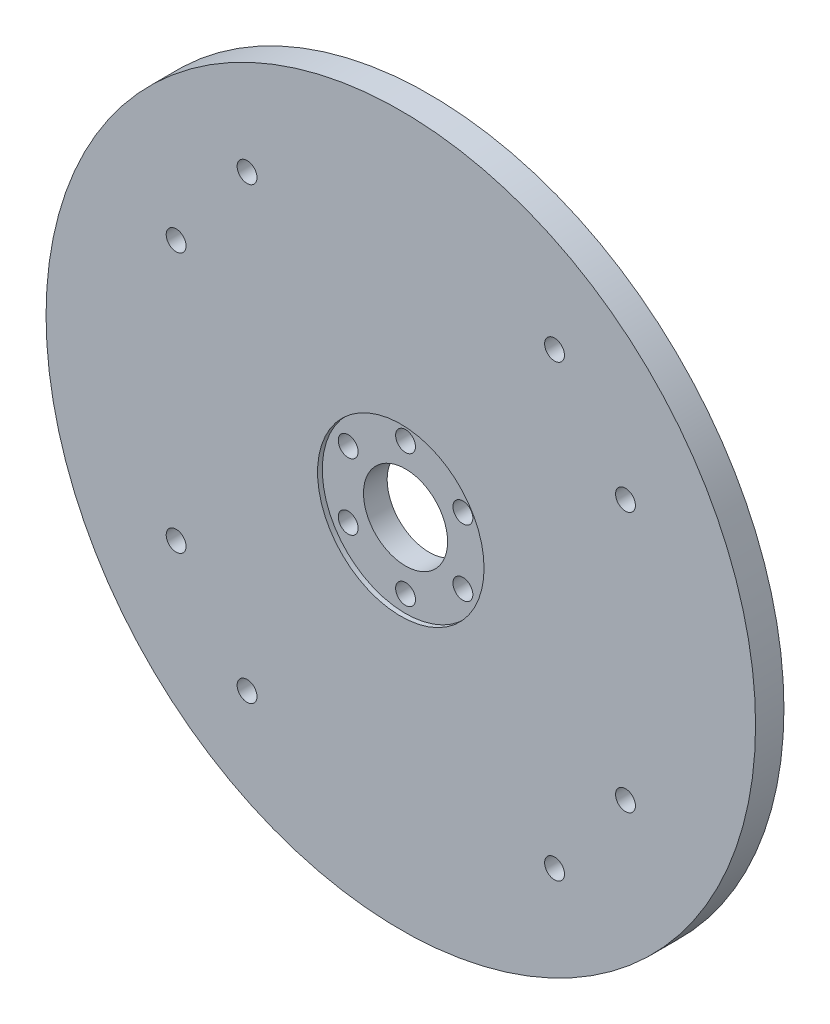
from build123d import *

# Parameters (mm, degrees)
SKETCH_1_R           = 40
EXTRUDE_1_DEPTH      = 2
SKETCH_2_R           = 34
CUT_EXTRUDE_1_DEPTH  = 0.5
SKETCH_3_R           = 17.5
CUT_EXTRUDE_4_DEPTH  = 1
SKETCH_5_R           = 2
CUT_EXTRUDE_5_DEPTH  = 1
SKETCH_6_R           = 8
CUT_EXTRUDE_6_DEPTH  = 10
SKETCH_7_R           = 2.1
CUT_EXTRUDE_7_DEPTH  = 10
SKETCH_8_R           = 70
SKETCH_8_R_2         = 40
EXTRUDE_2_DEPTH      = 2
EXTRUDE_3_DEPTH      = 2
SKETCH_11_R          = 75
SKETCH_11_R_2        = 2.1
SKETCH_11_R_3        = 8
EXTRUDE_4_DEPTH      = 2
SKETCH_13_W          = 95.696329608
SKETCH_13_H          = 36
SKETCH_13_W_2        = 36
SKETCH_13_H_2        = 100.137159233
SKETCH_13_H_3        = 96.241749767
CUT_EXTRUDE_10_DEPTH = 198
SKETCH_11_3_R        = 75
SKETCH_11_3_R_2      = 2.1
SKETCH_11_3_R_3      = 8
EXTRUDE_5_DEPTH      = 2
SKETCH_17_R          = 1.65
CUT_EXTRUDE_12_DEPTH = 280
SKETCH_18_R          = 234.864992374
CUT_EXTRUDE_13_DEPTH = 222
SKETCH_20_R          = 8.888358942
CUT_EXTRUDE_15_DEPTH = 17
SKETCH_28_R          = 17.5
CUT_EXTRUDE_16_DEPTH = 1
SKETCH_34_R          = 17.6
CUT_EXTRUDE_22_DEPTH = 1
SKETCH_30_R          = 2.1
CUT_EXTRUDE_27_DEPTH = 10
SKETCH_33_R          = 2.1
CUT_EXTRUDE_28_DEPTH = 10
EXTRUDE_START        = 4
SKETCH_40_R          = 75
SKETCH_40_R_2        = 8.888358942
SKETCH_40_R_3        = 2.1
EXTRUDE_6_DEPTH      = 4


with BuildPart() as part:
    # 草图1 → 凸台-拉伸1 (new body)
    with BuildSketch(Plane.XY):
        Circle(SKETCH_1_R)
    extrude(amount=EXTRUDE_1_DEPTH)

    # 草图2 → 切除-拉伸1 (cut)
    with BuildSketch(Plane.XY.offset(2)):
        Circle(SKETCH_2_R)
    extrude(amount=-CUT_EXTRUDE_1_DEPTH, mode=Mode.SUBTRACT)

    # 草图3 → 切除-拉伸4 (cut)
    with BuildSketch(Plane.XY.offset(1.5)):
        Circle(SKETCH_3_R)
    extrude(amount=-CUT_EXTRUDE_4_DEPTH, mode=Mode.SUBTRACT)

    # 草图5 → 切除-拉伸5 (cut)
    with BuildSketch(Plane.XY.offset(0.5)):
        with Locations((0, 14)):
            Circle(SKETCH_5_R)
        with Locations((12.124355653, 7)):
            Circle(SKETCH_5_R)
        with Locations((12.124355653, -7)):
            Circle(SKETCH_5_R)
        with Locations((0, -14)):
            Circle(SKETCH_5_R)
        with Locations((-12.124355653, -7)):
            Circle(SKETCH_5_R)
        with Locations((-12.124355653, 7)):
            Circle(SKETCH_5_R)
    extrude(amount=-CUT_EXTRUDE_5_DEPTH, mode=Mode.SUBTRACT)

    # 草图6 → 切除-拉伸6 (cut)
    with BuildSketch(Plane(origin=(0, 0, 0), x_dir=(-1, 0, 0), z_dir=(0, 0, -1))):
        Circle(SKETCH_6_R)
    extrude(amount=-CUT_EXTRUDE_6_DEPTH, mode=Mode.SUBTRACT)

    # 草图7 → 切除-拉伸7 (cut)
    with BuildSketch(Plane(origin=(0, 0, 0), x_dir=(-1, 0, 0), z_dir=(0, 0, -1))):
        with Locations((0, 14)):
            Circle(SKETCH_7_R)
        with Locations((12.124355653, 7)):
            Circle(SKETCH_7_R)
        with Locations((12.124355653, -7)):
            Circle(SKETCH_7_R)
        with Locations((0, -14)):
            Circle(SKETCH_7_R)
        with Locations((-12.124355653, -7)):
            Circle(SKETCH_7_R)
        with Locations((-12.124355653, 7)):
            Circle(SKETCH_7_R)
    extrude(amount=-CUT_EXTRUDE_7_DEPTH, mode=Mode.SUBTRACT)

    # 草图8 → 凸台-拉伸2 (add)
    with BuildSketch(Plane(origin=(0, 0, 0), x_dir=(-1, 0, 0), z_dir=(0, 0, -1))):
        Circle(SKETCH_8_R)
        Circle(SKETCH_8_R_2, mode=Mode.SUBTRACT)
    extrude(amount=-EXTRUDE_2_DEPTH)

    # 草图9 → 凸台-拉伸3 (add)
    with BuildSketch(Plane(origin=(0, 0, 0), x_dir=(-1, 0, 0), z_dir=(0, 0, -1))):
        with BuildLine():
            ThreePointArc((-36.858328143, 59.510197836), (-0.940414163, 69.993682724), (35.246189577, 60.478972547))
            Line((35.246189577, 60.478972547), (35.246189577, 159.510197836))
            Line((35.246189577, 159.510197836), (-36.858328143, 159.510197836))
            Line((-36.858328143, 159.510197836), (-36.858328143, 59.510197836))
        make_face()
        with BuildLine():
            ThreePointArc((-60, -36.055512755), (-70, 0), (-60, 36.055512755))
            Line((-60, 36.055512755), (-160, 36.055512755))
            Line((-160, 36.055512755), (-160, -36.055512755))
            Line((-160, -36.055512755), (-60, -36.055512755))
        make_face()
        with BuildLine():
            Line((160, 36.055512755), (60, 36.055512755))
            ThreePointArc((60, 36.055512755), (70, 0), (60, -36.055512755))
            Line((60, -36.055512755), (160, -36.055512755))
            Line((160, -36.055512755), (160, 36.055512755))
        make_face()
        with BuildLine():
            ThreePointArc((35.246189577, -60.478972547), (-0.940414163, -69.993682724), (-36.858328143, -59.510197836))
            Line((-36.858328143, -59.510197836), (-36.858328143, -160.478972547))
            Line((-36.858328143, -160.478972547), (35.246189577, -160.478972547))
            Line((35.246189577, -160.478972547), (35.246189577, -60.478972547))
        make_face()
    extrude(amount=-EXTRUDE_3_DEPTH)

    # 草图11 → 凸台-拉伸4 (add)
    with BuildSketch(Plane(origin=(0, 0, 0), x_dir=(-1, 0, 0), z_dir=(0, 0, -1))):
        Circle(SKETCH_11_R)
        with Locations((0, -14)):
            Circle(SKETCH_11_R_2, mode=Mode.SUBTRACT)
        with Locations((-12.124355653, -7)):
            Circle(SKETCH_11_R_2, mode=Mode.SUBTRACT)
        with Locations((-12.124355653, 7)):
            Circle(SKETCH_11_R_2, mode=Mode.SUBTRACT)
        Circle(SKETCH_11_R_3, mode=Mode.SUBTRACT)
        with Locations((12.124355653, -7)):
            Circle(SKETCH_11_R_2, mode=Mode.SUBTRACT)
        with Locations((12.124355653, 7)):
            Circle(SKETCH_11_R_2, mode=Mode.SUBTRACT)
        with Locations((0, 14)):
            Circle(SKETCH_11_R_2, mode=Mode.SUBTRACT)
    extrude(amount=-EXTRUDE_4_DEPTH)

    # 草图13 → 切除-拉伸10 (cut)
    with BuildSketch(Plane(origin=(0, 0, 0), x_dir=(-1, 0, 0), z_dir=(0, 0, -1))):
        with Locations((-112.151835196, 0)):
            Rectangle(SKETCH_13_W, SKETCH_13_H)
        with Locations((0, 109.44161822)):
            Rectangle(SKETCH_13_W_2, SKETCH_13_H_2)
        Polygon((160, -18), (160, 18), (157.649128195, 18), (52.463986971, 18), (52.463986971, -18), align=None)
        with Locations((0, -112.358097664)):
            Rectangle(SKETCH_13_W_2, SKETCH_13_H_3)
    extrude(amount=-CUT_EXTRUDE_10_DEPTH, mode=Mode.SUBTRACT)

    # 草图11<3> → 凸台-拉伸5 (add)
    with BuildSketch(Plane(origin=(0, 0, 0), x_dir=(-1, 0, 0), z_dir=(0, 0, -1))):
        Circle(SKETCH_11_3_R)
        with Locations((0, -14)):
            Circle(SKETCH_11_3_R_2, mode=Mode.SUBTRACT)
        with Locations((-12.124355653, -7)):
            Circle(SKETCH_11_3_R_2, mode=Mode.SUBTRACT)
        with Locations((-12.124355653, 7)):
            Circle(SKETCH_11_3_R_2, mode=Mode.SUBTRACT)
        Circle(SKETCH_11_3_R_3, mode=Mode.SUBTRACT)
        with Locations((12.124355653, -7)):
            Circle(SKETCH_11_3_R_2, mode=Mode.SUBTRACT)
        with Locations((12.124355653, 7)):
            Circle(SKETCH_11_3_R_2, mode=Mode.SUBTRACT)
        with Locations((0, 14)):
            Circle(SKETCH_11_3_R_2, mode=Mode.SUBTRACT)
    extrude(amount=-EXTRUDE_5_DEPTH)

    # 草图17 → 切除-拉伸12 (cut)
    with BuildSketch(Plane(origin=(0, 0, 0), x_dir=(-1, 0, 0), z_dir=(0, 0, -1))):
        with Locations((-157.6, 27.027756377)):
            Circle(SKETCH_17_R)
        with Locations((-132.6, 27.027756377)):
            Circle(SKETCH_17_R)
        with Locations((-157.6, -27.027756377)):
            Circle(SKETCH_17_R)
        with Locations((-132.6, -27.027756377)):
            Circle(SKETCH_17_R)
        with Locations((27.027756377, 157.6)):
            Circle(SKETCH_17_R)
        with Locations((27.027756377, 132.6)):
            Circle(SKETCH_17_R)
        with Locations((-27.027756377, 157.6)):
            Circle(SKETCH_17_R)
        with Locations((-27.027756377, 132.6)):
            Circle(SKETCH_17_R)
        with Locations((157.6, 27.027756377)):
            Circle(SKETCH_17_R)
        with Locations((132.6, 27.027756377)):
            Circle(SKETCH_17_R)
        with Locations((-27.027756377, -157.6)):
            Circle(SKETCH_17_R)
        with Locations((-27.027756377, -132.6)):
            Circle(SKETCH_17_R)
        with Locations((27.027756377, -157.6)):
            Circle(SKETCH_17_R)
        with Locations((27.027756377, -132.6)):
            Circle(SKETCH_17_R)
    extrude(amount=-CUT_EXTRUDE_12_DEPTH, mode=Mode.SUBTRACT)

    # 草图18 → 切除-拉伸13 (cut)
    with BuildSketch(Plane(origin=(0, 0, 0), x_dir=(-1, 0, 0), z_dir=(0, 0, -1))):
        Circle(SKETCH_18_R)
        with BuildLine():
            ThreePointArc((72.807966597, -18), (-74.999955067, -0.082097142), (72.768385514, 18.159352128))
            ThreePointArc((72.768385514, 18.159352128), (74.440005755, 9.147980282), (75, 0))
            ThreePointArc((75, 0), (74.449974798, -9.066490645), (72.807966597, -18))
        make_face(mode=Mode.SUBTRACT)
        with BuildLine():
            ThreePointArc((159.25, 27.027756377), (157.6, 25.377756377), (155.95, 27.027756377))
            ThreePointArc((155.95, 27.027756377), (157.6, 28.677756377), (159.25, 27.027756377))
        make_face(mode=Mode.SUBTRACT)
    extrude(amount=-CUT_EXTRUDE_13_DEPTH, mode=Mode.SUBTRACT)

    # 草图20 → 切除-拉伸15 (cut)
    with BuildSketch(Plane(origin=(0, 0, 0), x_dir=(-1, 0, 0), z_dir=(0, 0, -1))):
        Circle(SKETCH_20_R)
    extrude(amount=-CUT_EXTRUDE_15_DEPTH, mode=Mode.SUBTRACT)

    # 草图28 → 切除-拉伸16 (cut)
    with BuildSketch(Plane.XY.offset(2)):
        Circle(SKETCH_28_R)
    extrude(amount=-CUT_EXTRUDE_16_DEPTH, mode=Mode.SUBTRACT)

    # 草图34 → 切除-拉伸22 (cut)
    with BuildSketch(Plane.XY.offset(2)):
        Circle(SKETCH_34_R)
    extrude(amount=-CUT_EXTRUDE_22_DEPTH, mode=Mode.SUBTRACT)

    # 草图30 → 切除-拉伸27 (cut)
    with BuildSketch(Plane(origin=(0, 0, 0), x_dir=(-1, 0, 0), z_dir=(0, 0, -1))):
        with Locations((-32.5, -47.5)):
            Circle(SKETCH_30_R)
        with Locations((32.5, -47.5)):
            Circle(SKETCH_30_R)
        with Locations((-32.5, 47.5)):
            Circle(SKETCH_30_R)
        with Locations((32.5, 47.5)):
            Circle(SKETCH_30_R)
    extrude(amount=-CUT_EXTRUDE_27_DEPTH, mode=Mode.SUBTRACT)

    # 草图33 → 切除-拉伸28 (cut)
    with BuildSketch(Plane(origin=(0, 0, 0), x_dir=(-1, 0, 0), z_dir=(0, 0, -1))):
        with Locations((-47.5, 27.5)):
            Circle(SKETCH_33_R)
        with Locations((-47.5, -27.5)):
            Circle(SKETCH_33_R)
        with Locations((47.5, 27.5)):
            Circle(SKETCH_33_R)
        with Locations((47.5, -27.5)):
            Circle(SKETCH_33_R)
    extrude(amount=-CUT_EXTRUDE_28_DEPTH, mode=Mode.SUBTRACT)

    # 草图40 → 凸台-拉伸6 (add)
    with BuildSketch(Plane(origin=(0, 0, 0), x_dir=(-1, 0, 0), z_dir=(0, 0, -1)).offset(EXTRUDE_START)):
        Circle(SKETCH_40_R)
        Circle(SKETCH_40_R_2, mode=Mode.SUBTRACT)
        with Locations((-12.124355653, 7)):
            Circle(SKETCH_40_R_3, mode=Mode.SUBTRACT)
        with Locations((-12.124355653, -7)):
            Circle(SKETCH_40_R_3, mode=Mode.SUBTRACT)
        with Locations((0, -14)):
            Circle(SKETCH_40_R_3, mode=Mode.SUBTRACT)
        with Locations((12.124355653, -7)):
            Circle(SKETCH_40_R_3, mode=Mode.SUBTRACT)
        with Locations((12.124355653, 7)):
            Circle(SKETCH_40_R_3, mode=Mode.SUBTRACT)
        with Locations((0, 14)):
            Circle(SKETCH_40_R_3, mode=Mode.SUBTRACT)
        with Locations((32.5, 47.5)):
            Circle(SKETCH_40_R_3, mode=Mode.SUBTRACT)
        with Locations((47.5, 27.5)):
            Circle(SKETCH_40_R_3, mode=Mode.SUBTRACT)
        with Locations((47.5, -27.5)):
            Circle(SKETCH_40_R_3, mode=Mode.SUBTRACT)
        with Locations((32.5, -47.5)):
            Circle(SKETCH_40_R_3, mode=Mode.SUBTRACT)
        with Locations((-32.5, -47.5)):
            Circle(SKETCH_40_R_3, mode=Mode.SUBTRACT)
        with Locations((-47.5, -27.5)):
            Circle(SKETCH_40_R_3, mode=Mode.SUBTRACT)
        with Locations((-47.5, 27.5)):
            Circle(SKETCH_40_R_3, mode=Mode.SUBTRACT)
        with Locations((-32.5, 47.5)):
            Circle(SKETCH_40_R_3, mode=Mode.SUBTRACT)
    extrude(amount=-EXTRUDE_6_DEPTH)


solid = part.part
